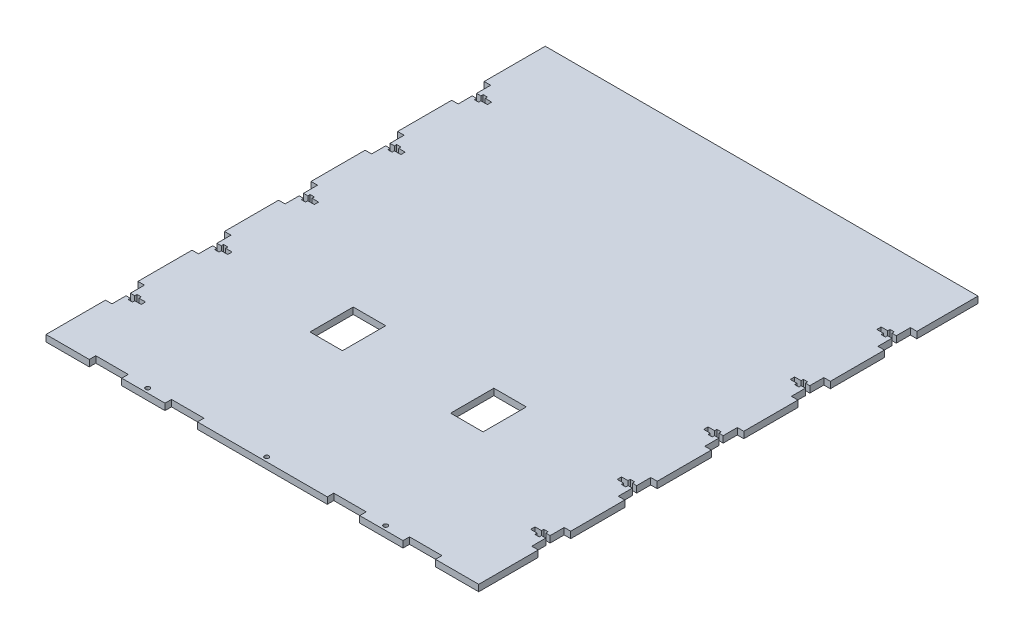
from build123d import *

# Parameters (mm, degrees)
SKETCH_1_W             = 200
SKETCH_1_H             = 230.75
EXTRUDE_1_DEPTH        = 3
SKETCH_2_W             = 3
SKETCH_2_H             = 15
CUT_EXTRUDE_1_DEPTH    = 306.37610008
PATTERN_LINEAR_1_COUNT = 5
PATTERN_LINEAR_1_PITCH = 40
SKETCH_3_W             = 15
SKETCH_3_H             = 3
CUT_EXTRUDE_2_DEPTH    = 306.37610008
SKETCH_4_R             = 1
CUT_EXTRUDE_3_DEPTH    = 306.37610008
CUT_EXTRUDE_4_DEPTH    = 306.37610008
PATTERN_LINEAR_2_COUNT = 5
PATTERN_LINEAR_2_PITCH = 40
MIRROR_1_COPY_1_DEPTH  = 306.37610008
MIRROR_1_COPY_2_DEPTH  = 306.37610008
MIRROR_1_COPY_3_DEPTH  = 306.37610008
MIRROR_1_COPY_4_DEPTH  = 306.37610008
SKETCH_6_W             = 15
SKETCH_6_H             = 20
CUT_EXTRUDE_5_DEPTH    = 306.37610008


with BuildPart() as part:
    # 草图1 → 凸台-拉伸1 (new body)
    with BuildSketch(Plane(origin=(0, 0, 0), x_dir=(1, 0, 0), z_dir=(0, 1, 0))):
        with Locations((100, 115.375)):
            Rectangle(SKETCH_1_W, SKETCH_1_H)
    extrude(amount=EXTRUDE_1_DEPTH)

    # 草图2 → 切除-拉伸1 (cut, through all)
    with BuildSketch(Plane(origin=(0, 3, 0), x_dir=(1, 0, 0), z_dir=(0, 1, 0))):
        with Locations((1.5, 195)):
            Rectangle(SKETCH_2_W, SKETCH_2_H)
        with Locations((198.5, 195)):
            Rectangle(SKETCH_2_W, SKETCH_2_H)
    cut_extrude_1 = extrude(amount=-CUT_EXTRUDE_1_DEPTH, mode=Mode.SUBTRACT)

    # 阵列(线性)1: 切除-拉伸1 ×5
    with Locations(*[(0, 0, i * PATTERN_LINEAR_1_PITCH) for i in range(1, PATTERN_LINEAR_1_COUNT)]):
        add(cut_extrude_1, mode=Mode.SUBTRACT)

    # 草图3 → 切除-拉伸2 (cut, through all)
    with BuildSketch(Plane(origin=(0, 3, 0), x_dir=(1, 0, 0), z_dir=(0, 1, 0))):
        with Locations((27.5, 1.5)):
            Rectangle(SKETCH_3_W, SKETCH_3_H)
        with Locations((62.5, 1.5)):
            Rectangle(SKETCH_3_W, SKETCH_3_H)
        with Locations((137.5, 1.5)):
            Rectangle(SKETCH_3_W, SKETCH_3_H)
        with Locations((172.5, 1.5)):
            Rectangle(SKETCH_3_W, SKETCH_3_H)
    extrude(amount=-CUT_EXTRUDE_2_DEPTH, mode=Mode.SUBTRACT)

    # 草图4 → 切除-拉伸3 (cut, through all)
    with BuildSketch(Plane(origin=(0, 3, 0), x_dir=(1, 0, 0), z_dir=(0, 1, 0))):
        with Locations(Location((100, 2, 0), (0, 0, 270))):
            Circle(SKETCH_4_R)
        with Locations(Location((45, 2, 0), (0, 0, 270))):
            Circle(SKETCH_4_R)
        with Locations(Location((155, 2, 0), (0, 0, 270))):
            Circle(SKETCH_4_R)
    extrude(amount=-CUT_EXTRUDE_3_DEPTH, mode=Mode.SUBTRACT)

    # 草图5 → 切除-拉伸4 (cut, through all)
    with BuildSketch(Plane(origin=(0, 3, 0), x_dir=(1, 0, 0), z_dir=(0, 1, 0))):
        Polygon((5, 197.05), (7, 197.05), (7, 196), (10, 196), (10, 194), (7, 194), (7, 192.95), (5, 192.95), (5, 194), (3, 194), (3, 196), (5, 196), align=None)
    cut_extrude_4 = extrude(amount=-CUT_EXTRUDE_4_DEPTH, mode=Mode.SUBTRACT)

    # 阵列(线性)2: 切除-拉伸4 ×5
    with Locations(*[(0, 0, i * PATTERN_LINEAR_2_PITCH) for i in range(1, PATTERN_LINEAR_2_COUNT)]):
        add(cut_extrude_4, mode=Mode.SUBTRACT)

    # 镜向1: 切除-拉伸4 across plane
    add(cut_extrude_4.mirror(Plane.ZY.offset(-100)), mode=Mode.SUBTRACT)

    # 镜向1 copy 1 sketch → 镜向1 copy 1 (cut, through all)
    with BuildSketch(Plane(origin=(200, 3, 40), x_dir=(-1, 0, 0), z_dir=(0, 1, 0))):
        Polygon((5, -197.05), (7, -197.05), (7, -196), (10, -196), (10, -194), (7, -194), (7, -192.95), (5, -192.95), (5, -194), (3, -194), (3, -196), (5, -196), align=None)
    extrude(amount=-MIRROR_1_COPY_1_DEPTH, mode=Mode.SUBTRACT)

    # 镜向1 copy 2 sketch → 镜向1 copy 2 (cut, through all)
    with BuildSketch(Plane(origin=(200, 3, 80), x_dir=(-1, 0, 0), z_dir=(0, 1, 0))):
        Polygon((5, -197.05), (7, -197.05), (7, -196), (10, -196), (10, -194), (7, -194), (7, -192.95), (5, -192.95), (5, -194), (3, -194), (3, -196), (5, -196), align=None)
    extrude(amount=-MIRROR_1_COPY_2_DEPTH, mode=Mode.SUBTRACT)

    # 镜向1 copy 3 sketch → 镜向1 copy 3 (cut, through all)
    with BuildSketch(Plane(origin=(200, 3, 120), x_dir=(-1, 0, 0), z_dir=(0, 1, 0))):
        Polygon((5, -197.05), (7, -197.05), (7, -196), (10, -196), (10, -194), (7, -194), (7, -192.95), (5, -192.95), (5, -194), (3, -194), (3, -196), (5, -196), align=None)
    extrude(amount=-MIRROR_1_COPY_3_DEPTH, mode=Mode.SUBTRACT)

    # 镜向1 copy 4 sketch → 镜向1 copy 4 (cut, through all)
    with BuildSketch(Plane(origin=(200, 3, 160), x_dir=(-1, 0, 0), z_dir=(0, 1, 0))):
        Polygon((5, -197.05), (7, -197.05), (7, -196), (10, -196), (10, -194), (7, -194), (7, -192.95), (5, -192.95), (5, -194), (3, -194), (3, -196), (5, -196), align=None)
    extrude(amount=-MIRROR_1_COPY_4_DEPTH, mode=Mode.SUBTRACT)

    # 草图6 → 切除-拉伸5 (cut, through all)
    with BuildSketch(Plane(origin=(0, 3, 0), x_dir=(1, 0, 0), z_dir=(0, 1, 0))):
        with Locations((67.5, 72)):
            Rectangle(SKETCH_6_W, SKETCH_6_H)
        with Locations((132.5, 72)):
            Rectangle(SKETCH_6_W, SKETCH_6_H)
    extrude(amount=-CUT_EXTRUDE_5_DEPTH, mode=Mode.SUBTRACT)


solid = part.part
